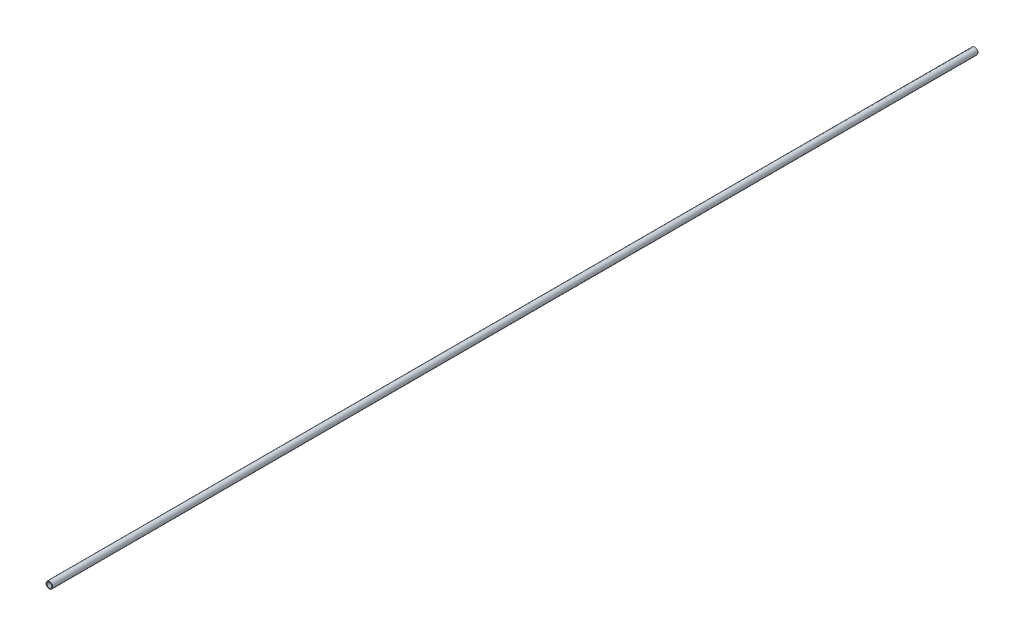
from build123d import *

# Parameters (mm, degrees)
SKETCH1_R           = 10.668
SKETCH1_R_2         = 7.8994
EXTRUDE_THIN1_DEPTH = 1500


with BuildPart() as part:
    # Sketch1 → Extrude-Thin1 (new, symmetric)
    with BuildSketch(Plane.XY):
        Circle(SKETCH1_R)
        Circle(SKETCH1_R_2, mode=Mode.SUBTRACT)
    extrude(amount=EXTRUDE_THIN1_DEPTH, both=True)


solid = part.part
